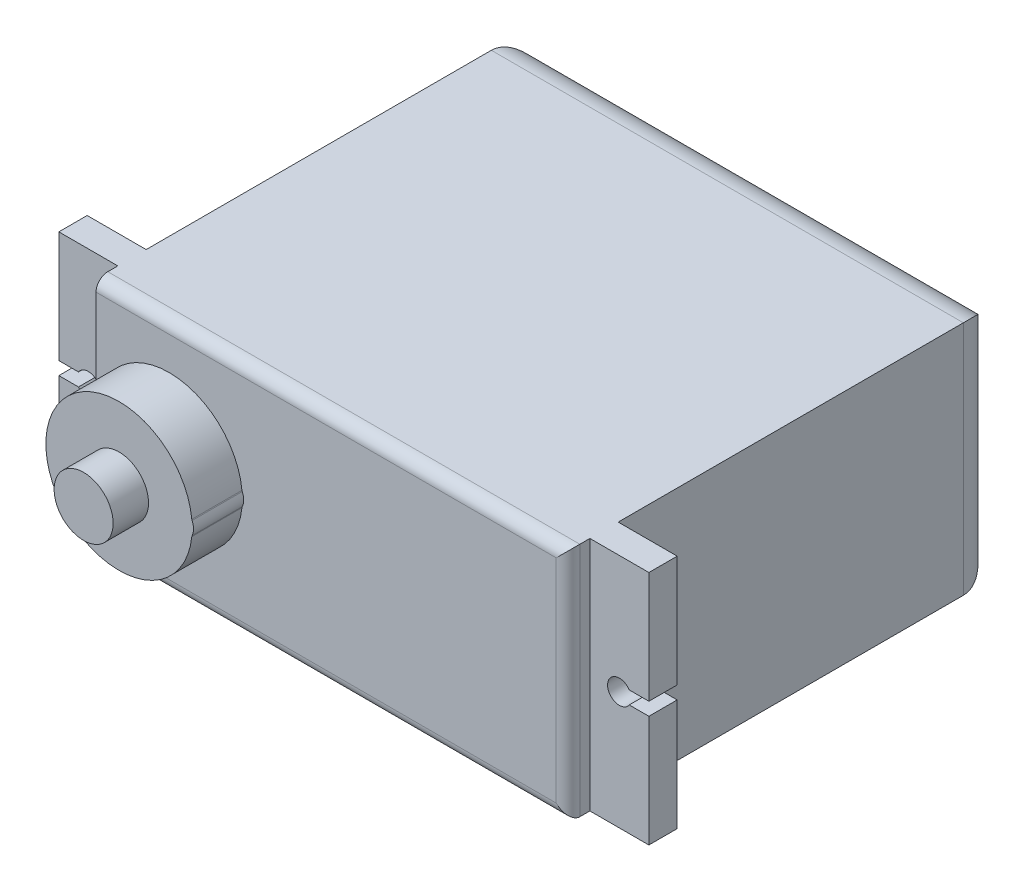
from build123d import *

# Parameters (mm, degrees)
SKETCH1_W           = 40
SKETCH1_H           = 20
BOSS_EXTRUDE1_DEPTH = 36.5
SKETCH2_W           = 5
SKETCH2_H           = 2.4
BOSS_EXTRUDE2_DEPTH = 20
CUT_EXTRUDE1_DEPTH  = 44.881915409
BOSS_EXTRUDE3_DEPTH = 4.25
SKETCH9_R           = 2.5
BOSS_EXTRUDE4_DEPTH = 3
FILLET1_R           = 3
FILLET2_R           = 1


with BuildPart() as part:
    # Sketch1 → Boss-Extrude1 (new body)
    with BuildSketch(Plane.XY):
        Rectangle(SKETCH1_W, SKETCH1_H)
    extrude(amount=BOSS_EXTRUDE1_DEPTH)

    # Sketch2 → Boss-Extrude2 (add)
    with BuildSketch(Plane.XZ.offset(10)):
        with Locations((22.5, 33.45)):
            Rectangle(SKETCH2_W, SKETCH2_H)
        with Locations((-22.5, 33.45)):
            Rectangle(SKETCH2_W, SKETCH2_H)
    extrude(amount=-BOSS_EXTRUDE2_DEPTH)

    # Sketch3 → Cut-Extrude1 (cut, through all)
    with BuildSketch(Plane.XY.offset(34.65)):
        with BuildLine():
            Line((25, -0.55), (23.335164654, -0.55))
            ThreePointArc((23.335164654, -0.55), (21.5, 0), (23.335164654, 0.55))
            Line((23.335164654, 0.55), (25, 0.55))
            Line((25, 0.55), (25, -0.55))
        make_face()
        with BuildLine():
            Line((-25, 0.55), (-23.335164654, 0.55))
            ThreePointArc((-23.335164654, 0.55), (-21.5, 0), (-23.335164654, -0.55))
            Line((-23.335164654, -0.55), (-25, -0.55))
            Line((-25, -0.55), (-25, 0.55))
        make_face()
    extrude(amount=-CUT_EXTRUDE1_DEPTH, mode=Mode.SUBTRACT)

    # Sketch4 → Boss-Extrude3 (add)
    with BuildSketch(Plane.XY.offset(36.5)):
        with BuildLine():
            ThreePointArc((-7.632955955, 0.638410329), (-20, 0), (-7.632955955, -0.638410329))
            ThreePointArc((-7.632955955, -0.638410329), (-7.625027484, -0.596751111), (-7.610171977, -0.557031281))
            ThreePointArc((-7.610171977, -0.557031281), (-7.484785169, 0), (-7.610171977, 0.557031281))
            ThreePointArc((-7.610171977, 0.557031281), (-7.625027484, 0.596751111), (-7.632955955, 0.638410329))
        make_face()
    extrude(amount=BOSS_EXTRUDE3_DEPTH)

    # Sketch9 → Boss-Extrude4 (add)
    with BuildSketch(Plane.XY.offset(40.75)):
        with Locations((-13.8, 0)):
            Circle(SKETCH9_R)
    extrude(amount=BOSS_EXTRUDE4_DEPTH)

    # Fillet1
    fillet1_edges = [part.edges().sort_by_distance(p)[0] for p in [
        (0, -10, 0),
        (-20, 0, 0),
        (0, 10, 0),
        (20, 0, 0),
    ]]
    fillet(fillet1_edges, radius=FILLET1_R)

    # Fillet2
    fillet2_edges = [part.edges().sort_by_distance(p)[0] for p in [
        (0, -10, 36.5),
        (20, 0, 36.5),
        (0, 10, 36.5),
    ]]
    fillet(fillet2_edges, radius=FILLET2_R)


solid = part.part
